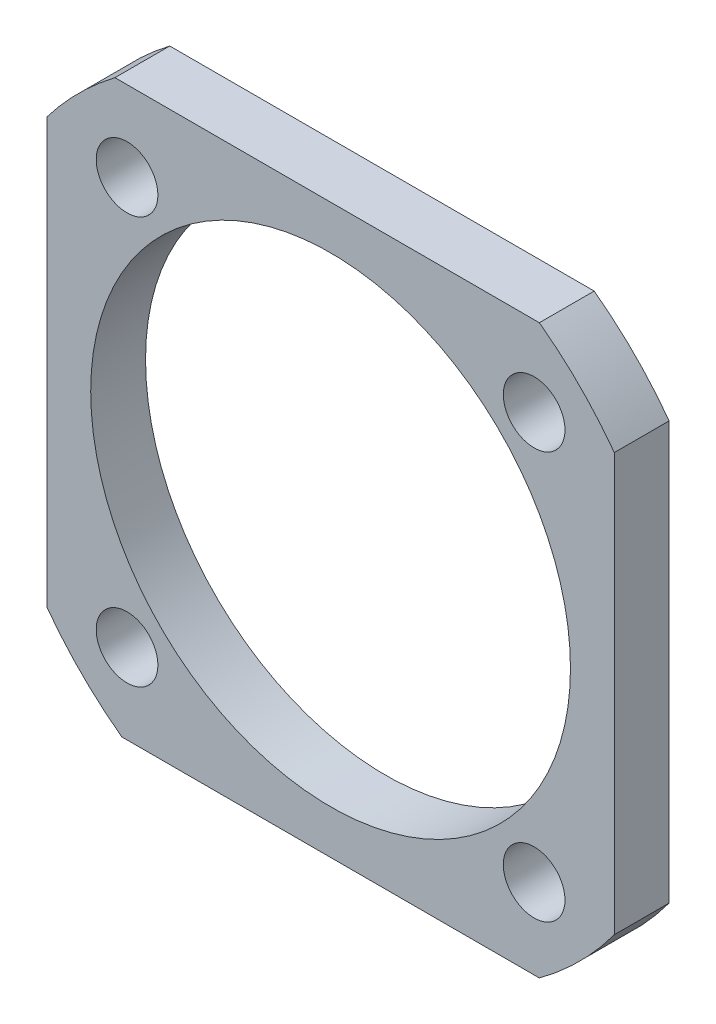
from build123d import *

# Parameters (mm, degrees)
SKETCH1_R           = 2.25
SKETCH1_R_2         = 17.5
BOSS_EXTRUDE1_DEPTH = 4


with BuildPart() as part:
    # Sketch1 → Boss-Extrude1 (new body)
    with BuildSketch(Plane.XY):
        with BuildLine():
            Line((-20.7, 15.73245054), (-20.7, -15.231546212))
            ThreePointArc((-20.7, -15.231546212), (-18.172644276, -18.172644276), (-15.231546212, -20.7))
            Line((-15.231546212, -20.7), (15.231546212, -20.7))
            ThreePointArc((15.231546212, -20.7), (18.172644276, -18.172644276), (20.7, -15.231546212))
            Line((20.7, -15.231546212), (20.7, 15.231546212))
            ThreePointArc((20.7, 15.231546212), (18.172644276, 18.172644276), (15.231546212, 20.7))
            Line((15.231546212, 20.7), (-15.73245054, 20.7))
            ThreePointArc((-15.73245054, 20.7), (-18.384776311, 18.384776311), (-20.7, 15.73245054))
        make_face()
        with Locations((-14.849242405, -14.849242405)):
            Circle(SKETCH1_R, mode=Mode.SUBTRACT)
        with Locations((-14.849242405, 14.849242405)):
            Circle(SKETCH1_R, mode=Mode.SUBTRACT)
        with Locations((14.849242405, 14.849242405)):
            Circle(SKETCH1_R, mode=Mode.SUBTRACT)
        with Locations((14.849242405, -14.849242405)):
            Circle(SKETCH1_R, mode=Mode.SUBTRACT)
        Circle(SKETCH1_R_2, mode=Mode.SUBTRACT)
    extrude(amount=BOSS_EXTRUDE1_DEPTH)


solid = part.part
